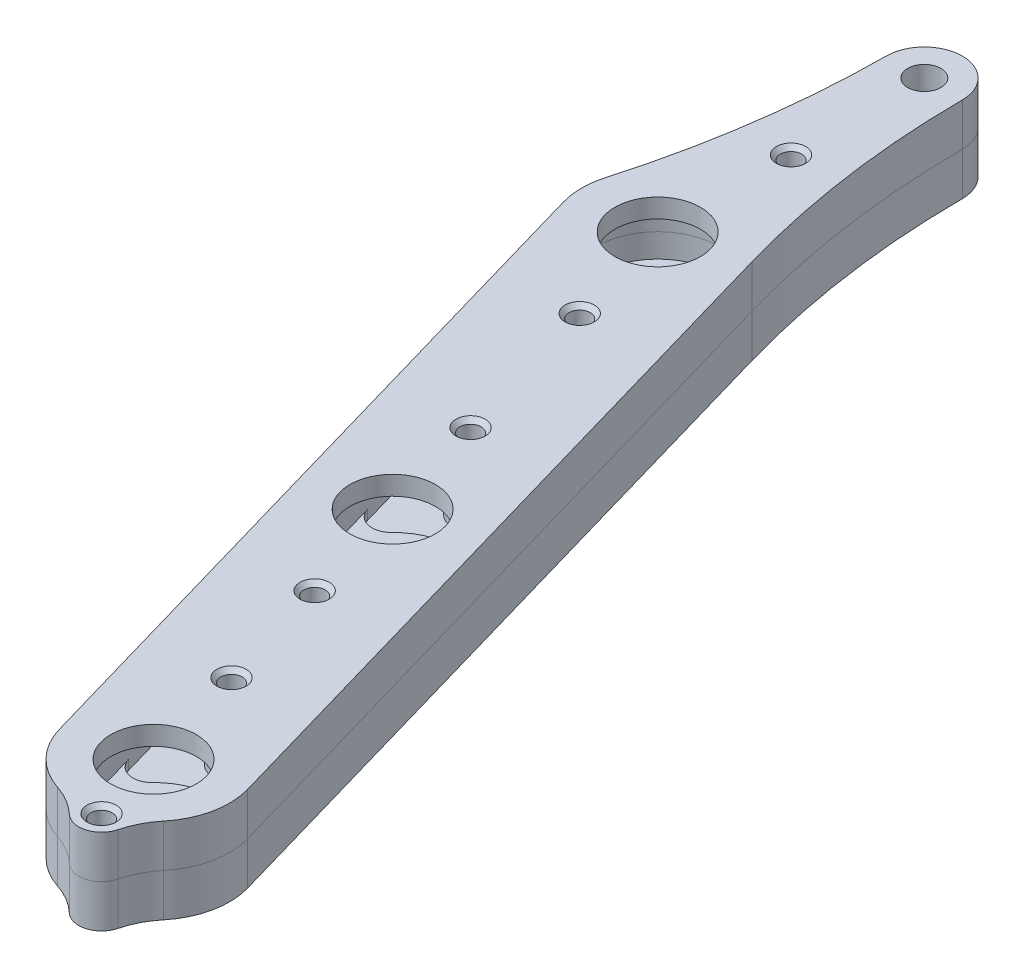
from build123d import *

# Parameters (mm, degrees)
SKETCH2_R                                  = 14.2875
SKETCH2_R_2                                = 5.55625
BOSS_EXTRUDE1_DEPTH                        = 14.2875
CUT_EXTRUDE1_DEPTH                         = 11.1125
CUT_EXTRUDE1_DEPTH_BACK                    = 11.1125
EXTRUDE_THIN1_START                        = -6.35
SKETCH4_R                                  = 21.9075
SKETCH4_R_2                                = 14.2875
EXTRUDE_THIN1_DEPTH                        = 6.35
FILLET1_R                                  = 6.35
FILLET1_OF_MIRROR1_R                       = 6.35
CSK_FOR_10_FLAT_HEAD_MACHINE_SCREW_2_COUNT = 2
CSK_FOR_10_FLAT_HEAD_MACHINE_SCREW_2_PITCH = 40.64
CSK_FOR_10_FLAT_HEAD_MACHINE_SCREW_3_COUNT = 2
CSK_FOR_10_FLAT_HEAD_MACHINE_SCREW_3_PITCH = 104.14
CSK_FOR_10_FLAT_HEAD_MACHINE_SCREW_4_COUNT = 2
CSK_FOR_10_FLAT_HEAD_MACHINE_SCREW_4_PITCH = 129.54
CSK_FOR_10_FLAT_HEAD_MACHINE_SCREW_5_COUNT = 2
CSK_FOR_10_FLAT_HEAD_MACHINE_SCREW_5_PITCH = 76.2
CSK_FOR_10_FLAT_HEAD_MACHINE_SCREW_6_COUNT = 2
CSK_FOR_10_FLAT_HEAD_MACHINE_SCREW_6_PITCH = 210.784351662
SKETCH8_R                                  = 3.556
CUT_EXTRUDE2_DEPTH                         = 13.335


with BuildPart() as part:
    # Sketch2 → Boss-Extrude1 (new, symmetric)
    with BuildSketch(Plane(origin=(0, 0, 0), x_dir=(1, 0, 0), z_dir=(0, 1, 0))):
        with BuildLine():
            Line((43.935184323, -243.758002901), (-24.403380417, -7.04521286))
            ThreePointArc((-24.403380417, -7.04521286), (-25.399975779, -0.035077308), (-24.422746143, 6.977784091))
            ThreePointArc((-24.422746143, 6.977784091), (-15.752732806, 47.650517021), (-12.699827995, 89.124847727))
            ThreePointArc((-12.699827995, 89.124847727), (0.018247535, 101.758736891), (12.699965499, 89.088352916))
            ThreePointArc((12.699965499, 89.088352916), (15.688600391, 47.658366948), (24.403380417, 7.04521286))
            Line((24.403380417, 7.04521286), (92.741945156, -229.667577182))
            ThreePointArc((92.741945156, -229.667577182), (93.200158546, -241.914823627), (87.870139834, -252.950941855))
            ThreePointArc((87.870139834, -252.950941855), (84.75918012, -257.679288395), (82.772532368, -262.979152738))
            ThreePointArc((82.772532368, -262.979152738), (77.497341457, -268.437184583), (70.124844873, -266.630517797))
            ThreePointArc((70.124844873, -266.630517797), (65.619186276, -263.20497084), (60.466816928, -260.862232818))
            ThreePointArc((60.466816928, -260.862232818), (50.074949386, -254.364995405), (43.935184323, -243.758002901))
        make_face()
        with Locations(Location((0, 0, 0), (0, 0, 270))):
            Circle(SKETCH2_R, mode=Mode.SUBTRACT)
        with Locations(Location((68.33856474, -236.712790042, 0), (0, 0, 270))):
            Circle(SKETCH2_R, mode=Mode.SUBTRACT)
        with Locations(Location((0, 89.05875, 0), (0, 0, 270))):
            Circle(SKETCH2_R_2, mode=Mode.SUBTRACT)
        with Locations(Location((35.930585585, -124.457240125, 0), (0, 0, 270))):
            Circle(SKETCH2_R, mode=Mode.SUBTRACT)
    extrude(amount=BOSS_EXTRUDE1_DEPTH, both=True)

    # Sketch3 → Cut-Extrude1 (cut, two sides: drawn at the far end of the back side and taken through both)
    with BuildSketch(Plane(origin=(0, 0, 0), x_dir=(1, 0, 0), z_dir=(0, 1, 0)).offset(-CUT_EXTRUDE1_DEPTH_BACK)):
        with BuildLine():
            Line((-19.522704333, -5.636170288), (48.815860406, -242.348960329))
            ThreePointArc((48.815860406, -242.348960329), (73.974735028, -256.235494375), (87.861269073, -231.076619754))
            Line((87.861269073, -231.076619754), (19.522704333, 5.636170288))
            ThreePointArc((19.522704333, 5.636170288), (-0.028061847, 20.319980623), (-19.538196915, 5.582227273))
            ThreePointArc((-19.538196915, 5.582227273), (-20.319980623, -0.028061847), (-19.522704333, -5.636170288))
        make_face()
        with BuildLine():
            Line((40.39755977, -162.823613965), (51.669900346, -201.869022632))
            ThreePointArc((51.669900346, -201.869022632), (59.532048665, -206.208564521), (63.871590554, -198.346416202))
            Line((63.871590554, -198.346416202), (52.599249979, -159.301007535))
            ThreePointArc((52.599249979, -159.301007535), (44.73710166, -154.961465646), (40.39755977, -162.823613965))
        make_face(mode=Mode.SUBTRACT)
        with BuildLine():
            Line((4.466974185, -38.36637384), (19.261921191, -89.613472715))
            ThreePointArc((19.261921191, -89.613472715), (27.12406951, -93.953014604), (31.463611399, -86.090866285))
            Line((31.463611399, -86.090866285), (16.668664394, -34.84376741))
            ThreePointArc((16.668664394, -34.84376741), (8.806516075, -30.504225521), (4.466974185, -38.36637384))
        make_face(mode=Mode.SUBTRACT)
    extrude(amount=CUT_EXTRUDE1_DEPTH + CUT_EXTRUDE1_DEPTH_BACK, mode=Mode.SUBTRACT)

    # Sketch4 → Extrude-Thin1 (add)
    # profile 1 of 3: a face of its own
    with BuildSketch(Plane(origin=(0, 14.2875, 0), x_dir=(1, 0, 0), z_dir=(0, 1, 0)).offset(EXTRUDE_THIN1_START)):
        with Locations((35.930585585, -124.457240125)):
            Circle(SKETCH4_R)
        with Locations((35.930585585, -124.457240125)):
            Circle(SKETCH4_R_2, mode=Mode.SUBTRACT)
    # profile 2 of 3: a face of its own
    with BuildSketch(Plane(origin=(0, 14.2875, 0), x_dir=(1, 0, 0), z_dir=(0, 1, 0)).offset(EXTRUDE_THIN1_START)):
        with Locations((68.33856474, -236.712790042)):
            Circle(SKETCH4_R)
        with Locations((68.33856474, -236.712790042)):
            Circle(SKETCH4_R_2, mode=Mode.SUBTRACT)
    # profile 3 of 3: a face of its own
    with BuildSketch(Plane(origin=(0, 14.2875, 0), x_dir=(1, 0, 0), z_dir=(0, 1, 0)).offset(EXTRUDE_THIN1_START)):
        Circle(SKETCH4_R)
        Circle(SKETCH4_R_2, mode=Mode.SUBTRACT)
    extrude_thin1 = extrude(amount=EXTRUDE_THIN1_DEPTH)

    # Fillet1
    fillet1_edges = [part.edges().sort_by_distance(p)[0] for p in [
        (85.59028047, 9.525, 223.210313949),
        (46.544871803, 9.525, 234.482654525),
        (-17.25171573, 9.525, 13.502476092),
        (21.793692937, 9.525, 2.230135517),
        (53.182301315, 9.525, 110.954764033),
        (14.136892648, 9.525, 122.227104608),
        (57.724278522, 9.525, 126.687375642),
        (18.678869855, 9.525, 137.959716217),
    ]]
    fillet(fillet1_edges, radius=FILLET1_R)

    # Mirror1: Extrude-Thin1 across plane
    add(extrude_thin1.mirror(Plane.ZX))

    # Fillet1 of Mirror1
    fillet1_of_mirror1_edges = [part.edges().sort_by_distance(p)[0] for p in [
        (85.59028047, -9.525, 223.210313949),
        (46.544871803, -9.525, 234.482654525),
        (-17.25171573, -9.525, 13.502476092),
        (21.793692937, -9.525, 2.230135517),
        (53.182301315, -9.525, 110.954764033),
        (14.136892648, -9.525, 122.227104608),
        (57.724278522, -9.525, 126.687375642),
        (18.678869855, -9.525, 137.959716217),
    ]]
    fillet(fillet1_of_mirror1_edges, radius=FILLET1_OF_MIRROR1_R)

    # Sketch7 → CSK for #10 Flat Head Machine Screw (100)1 (revolve, cut)
    with BuildSketch(Plane(origin=(46.498404874, -14.2875, 161.06231075), x_dir=(0, 0, -1), z_dir=(1, 0, 0))):
        Polygon((0, 0), (0, 28.575), (4.8895, 28.575), (2.8067, 26.179012681), (2.8067, 2.395987319), (4.8895, 0), align=None)
    csk_for_10_flat_head_machine_screw_100 = revolve(axis=Axis((46.498404874, -20.6375, 161.06231075), (0, 1, 0)), mode=Mode.SUBTRACT)

    # CSK for _10 Flat Head Machine Screw  2: CSK for #10 Flat Head Machine Screw (100)1 ×2
    with Locations(*[Vector(0.27737058503015216, 0, 0.9607630085302157) * (i * CSK_FOR_10_FLAT_HEAD_MACHINE_SCREW_2_PITCH) for i in range(1, CSK_FOR_10_FLAT_HEAD_MACHINE_SCREW_2_COUNT)]):
        add(csk_for_10_flat_head_machine_screw_100, mode=Mode.SUBTRACT)

    # CSK for _10 Flat Head Machine Screw  3: CSK for #10 Flat Head Machine Screw (100)1 ×2
    with Locations(*[Vector(0.2773705850301525, 0, 0.9607630085302156) * (i * CSK_FOR_10_FLAT_HEAD_MACHINE_SCREW_3_PITCH) for i in range(1, CSK_FOR_10_FLAT_HEAD_MACHINE_SCREW_3_COUNT)]):
        add(csk_for_10_flat_head_machine_screw_100, mode=Mode.SUBTRACT)

    # CSK for _10 Flat Head Machine Screw  4: CSK for #10 Flat Head Machine Screw (100)1 ×2
    with Locations(*[Vector(-0.2773705850301528, 0, -0.9607630085302155) * (i * CSK_FOR_10_FLAT_HEAD_MACHINE_SCREW_4_PITCH) for i in range(1, CSK_FOR_10_FLAT_HEAD_MACHINE_SCREW_4_COUNT)]):
        add(csk_for_10_flat_head_machine_screw_100, mode=Mode.SUBTRACT)

    # CSK for _10 Flat Head Machine Screw  5: CSK for #10 Flat Head Machine Screw (100)1 ×2
    with Locations(*[Vector(-0.2773705850301528, 0, -0.9607630085302155) * (i * CSK_FOR_10_FLAT_HEAD_MACHINE_SCREW_5_PITCH) for i in range(1, CSK_FOR_10_FLAT_HEAD_MACHINE_SCREW_5_COUNT)]):
        add(csk_for_10_flat_head_machine_screw_100, mode=Mode.SUBTRACT)

    # CSK for _10 Flat Head Machine Screw  6: CSK for #10 Flat Head Machine Screw (100)1 ×2
    with Locations(*[Vector(-0.22059704388827986, 0, -0.9753650312717554) * (i * CSK_FOR_10_FLAT_HEAD_MACHINE_SCREW_6_PITCH) for i in range(1, CSK_FOR_10_FLAT_HEAD_MACHINE_SCREW_6_COUNT)]):
        add(csk_for_10_flat_head_machine_screw_100, mode=Mode.SUBTRACT)

    # Sketch8 → Cut-Extrude2 (cut, symmetric)
    with BuildSketch(Plane(origin=(0, 0, 0), x_dir=(1, 0, 0), z_dir=(0, 1, 0))):
        with Locations(Location((57.77074545, -200.107719417, 0), (0, 0, 270))):
            Circle(SKETCH8_R)
        with Locations(Location((46.498404874, -161.06231075, 0), (0, 0, 270))):
            Circle(SKETCH8_R)
        with Locations(Location((0, 44.529375, 0), (0, 0, 270))):
            Circle(SKETCH8_R)
        with Locations(Location((10.56781929, -36.605070625, 0), (0, 0, 270))):
            Circle(SKETCH8_R)
        with Locations(Location((25.362766295, -87.8521695, 0), (0, 0, 270))):
            Circle(SKETCH8_R)
        with Locations(Location((75.383777599, -261.116170458, 0), (0, 0, 270))):
            Circle(SKETCH8_R)
    extrude(amount=CUT_EXTRUDE2_DEPTH, both=True, mode=Mode.SUBTRACT)


with BuildPart() as body_2:
    # Split2: the piece on the far side of the plane
    add(part.part)
    split(bisect_by=Plane.ZX, keep=Keep.BOTTOM)


with BuildPart() as part_1:
    add(part.part)

    # Split2
    split(bisect_by=Plane.ZX, keep=Keep.TOP)


solid = Compound([body_2.part, part_1.part])
